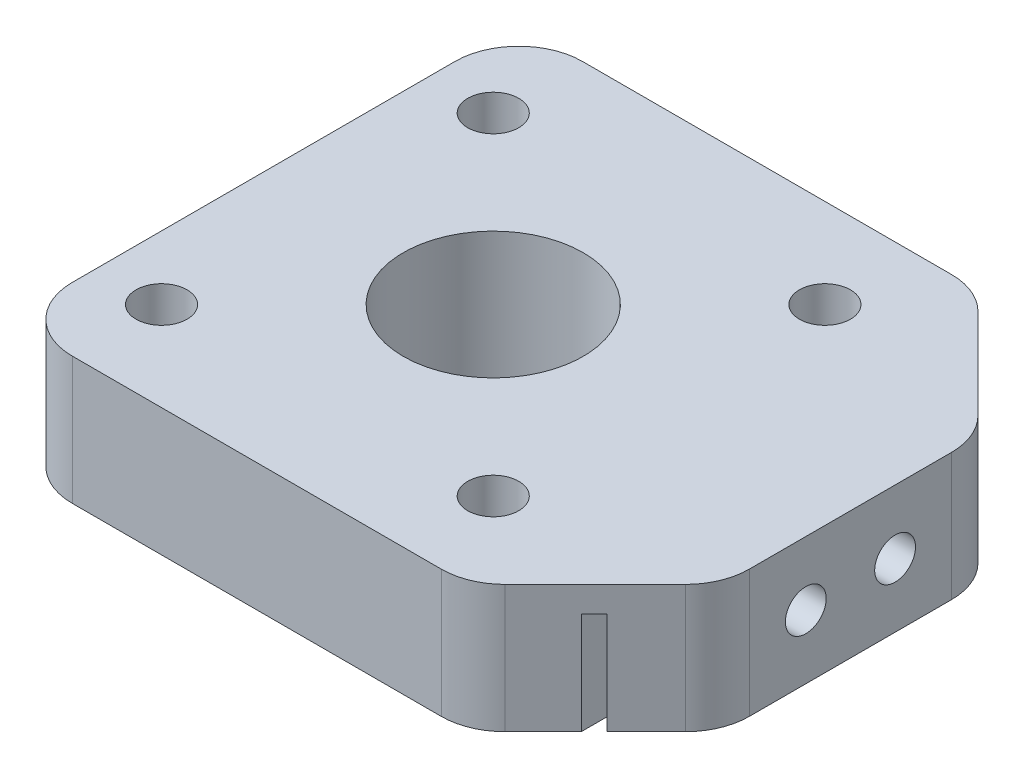
from build123d import *

# Parameters (mm, degrees)
SKETCH1_W               = 36
SKETCH1_H               = 40
SKETCH1_R               = 2
SKETCH1_R_2             = 7.05
BOSS_EXTRUDE1_DEPTH     = 10
BOSS_EXTRUDE2_DEPTH     = 10
FILLET1_R               = 5
CUT_EXTRUDE1_DEPTH      = 36.832945734
CUT_EXTRUDE1_DEPTH_BACK = 36.832945734
SKETCH4_W               = 1
SKETCH4_H               = 8
CUT_EXTRUDE2_REACH      = 53.147
SKETCH5_R               = 1.6


with BuildPart() as part:
    # Sketch1 → Boss-Extrude1 (new body)
    with BuildSketch(Plane(origin=(0, 0, 0), x_dir=(1, 0, 0), z_dir=(0, 1, 0))):
        Rectangle(SKETCH1_W, SKETCH1_H)
        with Locations(Location((-13, 13, 0), (0, 0, 270))):
            Circle(SKETCH1_R, mode=Mode.SUBTRACT)
        with Locations(Location((13, 13, 0), (0, 0, 90))):
            Circle(SKETCH1_R, mode=Mode.SUBTRACT)
        with Locations(Location((-13, -13, 0), (0, 0, 90))):
            Circle(SKETCH1_R, mode=Mode.SUBTRACT)
        with Locations(Location((13, -13, 0), (0, 0, 270))):
            Circle(SKETCH1_R, mode=Mode.SUBTRACT)
        with Locations(Location((0, 0, 0), (0, 0, 270))):
            Circle(SKETCH1_R_2, mode=Mode.SUBTRACT)
    extrude(amount=BOSS_EXTRUDE1_DEPTH)

    # Sketch3 → Boss-Extrude2 (add)
    with BuildSketch(Plane(origin=(0, 0, 0), x_dir=(1, 0, 0), z_dir=(0, 1, 0))):
        Polygon((18, 20), (18, -20), (28, -10), (28, 10), align=None)
    extrude(amount=BOSS_EXTRUDE2_DEPTH)

    # Fillet1
    fillet1_edges = [part.edges().sort_by_distance(p)[0] for p in [
        (28, 5, 10),
        (28, 5, -10),
        (18, 5, 20),
        (-18, 5, 20),
        (-18, 5, -20),
        (18, 5, -20),
    ]]
    fillet(fillet1_edges, radius=FILLET1_R)

    # Sketch4 → Cut-Extrude1 (cut, two sides: drawn at the far end of the back side and taken through both)
    with BuildSketch(Plane.XY.offset(-CUT_EXTRUDE1_DEPTH_BACK)):
        with Locations((22.95, 4)):
            Rectangle(SKETCH4_W, SKETCH4_H)
    extrude(amount=CUT_EXTRUDE1_DEPTH + CUT_EXTRUDE1_DEPTH_BACK, mode=Mode.SUBTRACT)

    # Sketch5 → Cut-Extrude2 (cut, up to next)
    with BuildSketch(Plane(origin=(28, 0, 0), x_dir=(0, 0, -1), z_dir=(1, 0, 0)), mode=Mode.PRIVATE) as cut_extrude2_sk1:
        with Locations((-3.5, 5)):
            Circle(SKETCH5_R)
    cut_extrude2_tool1 = extrude(cut_extrude2_sk1.sketch, amount=-CUT_EXTRUDE2_REACH, mode=Mode.PRIVATE) & part.part
    # Sketch5 → Cut-Extrude2 (cut, up to next)
    with BuildSketch(Plane(origin=(28, 0, 0), x_dir=(0, 0, -1), z_dir=(1, 0, 0)), mode=Mode.PRIVATE) as cut_extrude2_sk2:
        with Locations((3.5, 5)):
            Circle(SKETCH5_R)
    cut_extrude2_tool2 = extrude(cut_extrude2_sk2.sketch, amount=-CUT_EXTRUDE2_REACH, mode=Mode.PRIVATE) & part.part
    add(cut_extrude2_tool1.solids().sort_by_distance((28, 5, 3.5))[0], mode=Mode.SUBTRACT)
    add(cut_extrude2_tool2.solids().sort_by_distance((28, 5, -3.5))[0], mode=Mode.SUBTRACT)


solid = part.part
